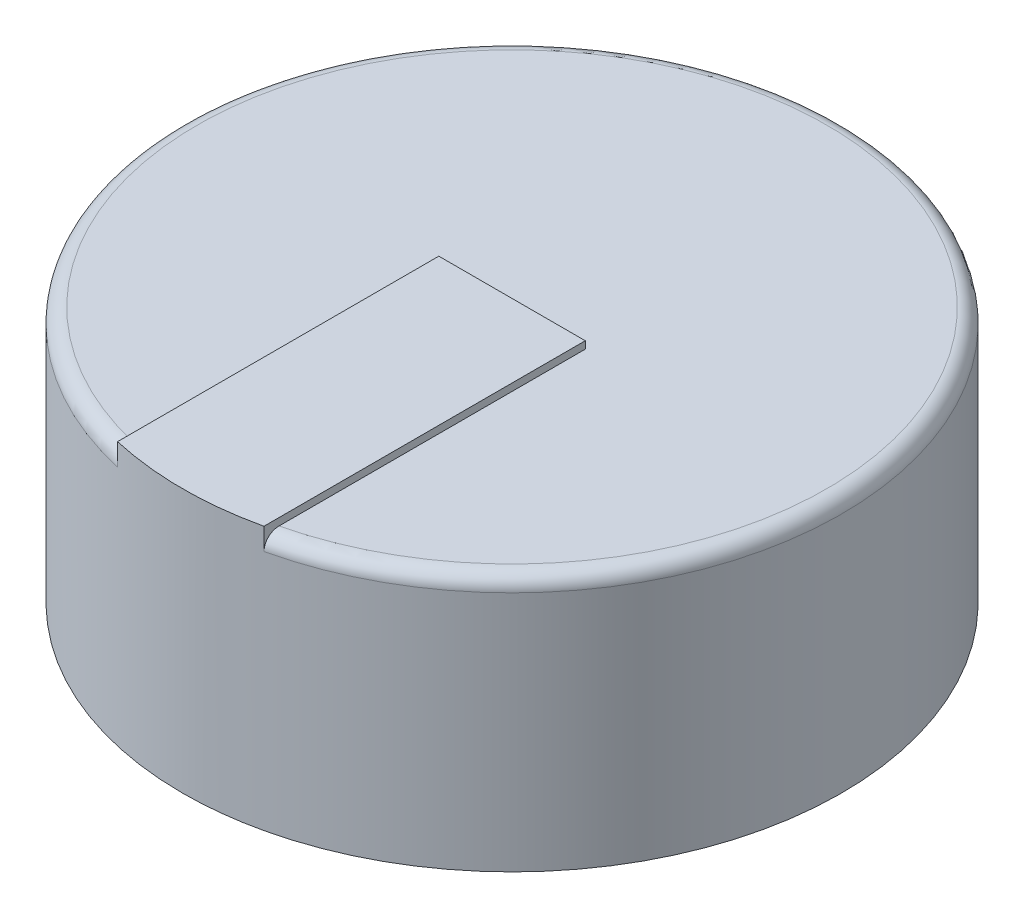
from build123d import *

# Parameters (mm, degrees)
SKETCH1_R           = 5.715
BOSS_EXTRUDE1_DEPTH = 4.445
FILLET2_R           = 0.254
SKETCH2_W           = 2.54
SKETCH2_H           = 5.715
CUT_EXTRUDE1_DEPTH  = 10.223907794
BOSS_EXTRUDE2_DEPTH = 4.572


with BuildPart() as part:
    # Sketch1 → Boss-Extrude1 (new body)
    with BuildSketch(Plane(origin=(0, 0, 0), x_dir=(1, 0, 0), z_dir=(0, 1, 0))):
        with Locations(Location((0, 0, 0), (0, 0, 270))):
            Circle(SKETCH1_R)
    extrude(amount=BOSS_EXTRUDE1_DEPTH)

    # Fillet2
    fillet2_edges = [part.edges().sort_by_distance(p)[0] for p in [
        (0, 4.445, -5.715),
    ]]
    fillet(fillet2_edges, radius=FILLET2_R)

    # Sketch2 → Cut-Extrude1 (cut, through all)
    with BuildSketch(Plane.XZ):
        with Locations((0, 2.8575)):
            Rectangle(SKETCH2_W, SKETCH2_H)
    extrude(amount=-CUT_EXTRUDE1_DEPTH, mode=Mode.SUBTRACT)

    # Sketch3 → Boss-Extrude2 (add)
    with BuildSketch(Plane.XZ):
        with BuildLine():
            Line((-1.27, 0), (-1.27, 5.572102386))
            ThreePointArc((-1.27, 5.572102386), (0, 5.715), (1.27, 5.572102386))
            Line((1.27, 5.572102386), (1.27, 0))
            Line((1.27, 0), (-1.27, 0))
        make_face()
    extrude(amount=-BOSS_EXTRUDE2_DEPTH)


solid = part.part
